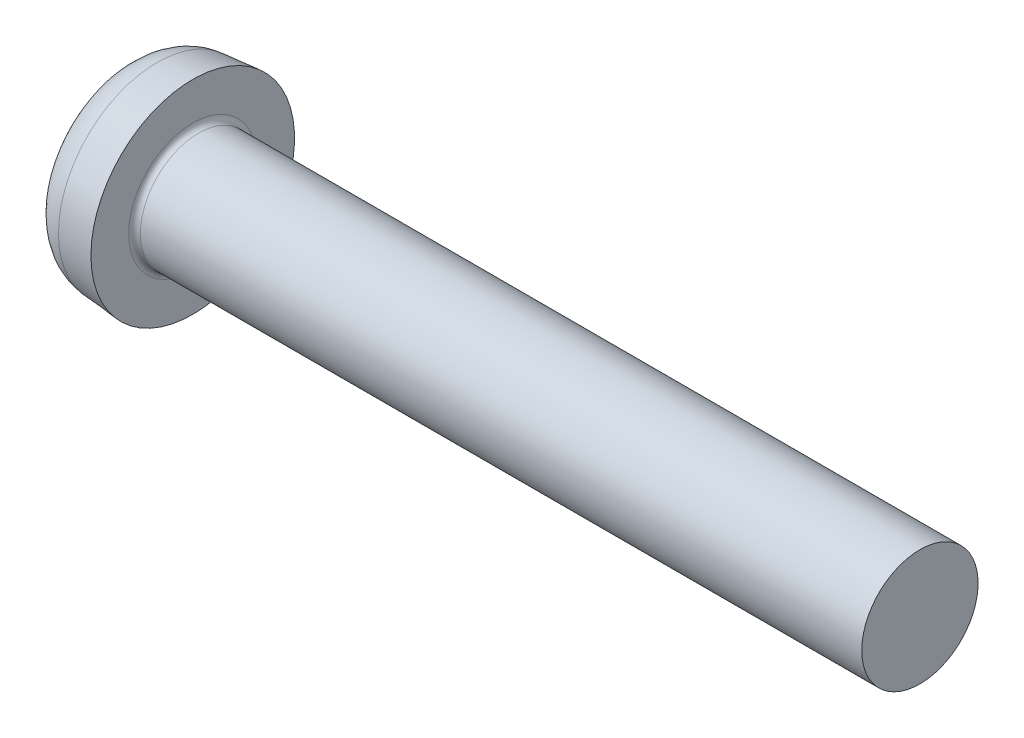
from build123d import *

# Parameters (mm, degrees)
FILLET1_R    = 0.4
RECPAT_COUNT = 2
RECPAT_ANGLE = 90


with BuildPart() as part:
    # BodySke → BaseBody (revolve)
    with BuildSketch(Plane.XY, mode=Mode.PRIVATE) as basebody_sk:
        with BuildLine():
            Line((5.4, 4), (5.4, 7))
            Line((5.4, 7), (2.956076559, 6.786184404))
            ThreePointArc((2.956076559, 6.786184404), (1.52557938, 6.199578276), (0.681056287, 4.904506975))
            ThreePointArc((0.681056287, 4.904506975), (0.171077054, 2.475784034), (0, 0))
            Line((0, 0), (55.4, 0))
            Line((55.4, 0), (55.4, 4))
            Line((55.4, 4), (5.4, 4))
        make_face()
    revolve(basebody_sk.sketch.rotate(Axis((0, 0, 0), (1, 0, 0)), 90), axis=Axis((0, 0, 0), (1, 0, 0)))

    # Fillet1
    fillet1_edges = [part.edges().sort_by_distance(p)[0] for p in [
        (5.4, 0, -4),
    ]]
    fillet(fillet1_edges, radius=FILLET1_R)

    # RecSkeTop → Recess section 0
    with BuildSketch(Plane(origin=(0, 0, 0), x_dir=(0, 0, -1), z_dir=(1, 0, 0))):
        with BuildLine():
            Line((-1.155, 5.25), (1.155, 5.25))
            Line((1.155, 5.25), (1.155, -5.25))
            Line((1.155, -5.25), (-1.155, -5.25))
            Line((-1.155, -5.25), (-1.155, 5.25))
        make_face()
    # RecSkeBot → Recess section 1
    with BuildSketch(Plane(origin=(4.36, 0, 0), x_dir=(0, 0, -1), z_dir=(1, 0, 0))):
        with BuildLine():
            Line((-1.155, 3.076184552), (1.155, 3.076184552))
            Line((1.155, 3.076184552), (1.155, -3.076184552))
            Line((1.155, -3.076184552), (-1.155, -3.076184552))
            Line((-1.155, -3.076184552), (-1.155, 3.076184552))
        make_face()
    recess = loft(mode=Mode.SUBTRACT)

    # RecPat: Recess ×2 about axis
    recpat_axis = Axis((0, 0, 0), (1, 0, 0))
    for i in range(1, RECPAT_COUNT):
        add(recess.rotate(recpat_axis, i * RECPAT_ANGLE / (RECPAT_COUNT - 1)), mode=Mode.SUBTRACT)

    # RecCorSke → RecessCore (revolve, cut)
    with BuildSketch(Plane.XY, mode=Mode.PRIVATE) as recesscore_sk:
        Polygon((0, 0), (0, 2.541), (4.36, 2.2361191), (5.086559139, 0), align=None)
    revolve(recesscore_sk.sketch.rotate(Axis((0, 0, 0), (1, 0, 0)), 90), axis=Axis((0, 0, 0), (1, 0, 0)), mode=Mode.SUBTRACT)


solid = part.part
